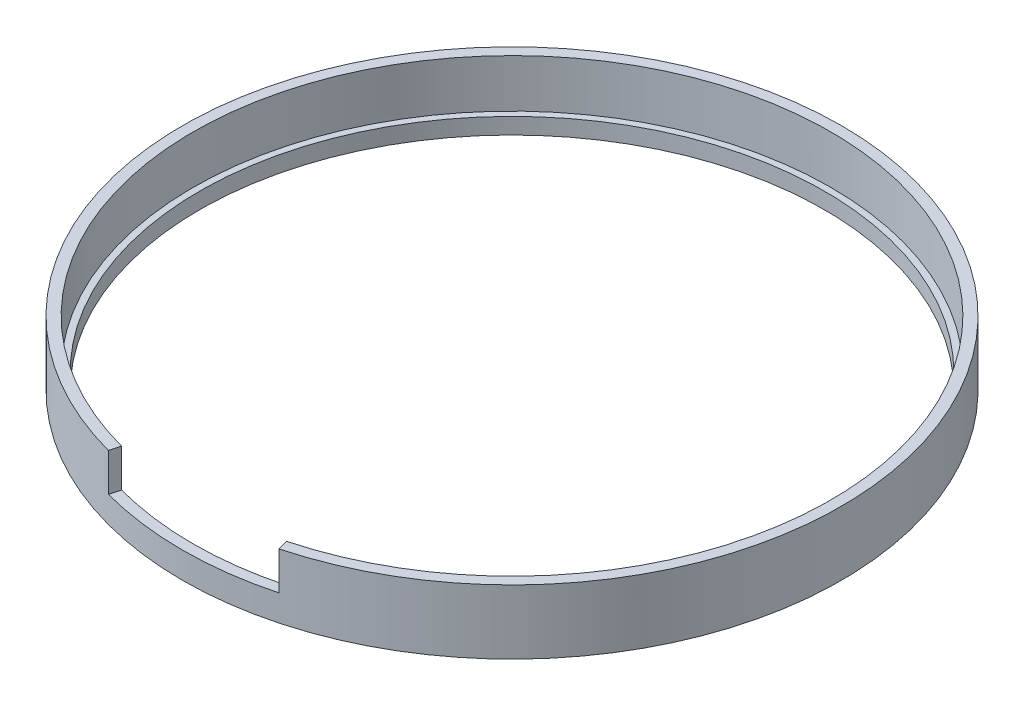
from build123d import *

# Parameters (mm, degrees)
SKETCH_1_R          = 200
SKETCH_1_R_2        = 193.5
EXTRUDE_1_DEPTH     = 39
SKETCH_1_5_R        = 193.5
SKETCH_1_5_R_2      = 189.6
EXTRUDE_2_DEPTH     = 9.8
CUT_EXTRUDE_START   = -23.1
CUT_EXTRUDE_1_DEPTH = 23.1


with BuildPart() as part:
    # 草图1 → 凸台-拉伸1 (new body)
    with BuildSketch(Plane(origin=(0, 0, 0), x_dir=(1, 0, 0), z_dir=(0, 1, 0))):
        with Locations(Location((0, 0, 0), (0, 0, 270))):
            Circle(SKETCH_1_R)
        with Locations(Location((0, 0, 0), (0, 0, 270))):
            Circle(SKETCH_1_R_2, mode=Mode.SUBTRACT)
    extrude(amount=EXTRUDE_1_DEPTH)

    # 草图1<5> → 凸台-拉伸2 (add)
    with BuildSketch(Plane(origin=(0, 0, 0), x_dir=(1, 0, 0), z_dir=(0, 1, 0))):
        with Locations(Location((0, 0, 0), (0, 0, 270))):
            Circle(SKETCH_1_5_R)
        with Locations(Location((0, 0, 0), (0, 0, 270))):
            Circle(SKETCH_1_5_R_2, mode=Mode.SUBTRACT)
    extrude(amount=EXTRUDE_2_DEPTH)

    # 草图4 → 切除-拉伸1 (cut)
    with BuildSketch(Plane(origin=(0, 39, 0), x_dir=(1, 0, 0), z_dir=(0, 1, 0)).offset(CUT_EXTRUDE_START)):
        with BuildLine():
            Line((-50.081485227, -186.906647387), (-51.763809021, -193.185165258))
            ThreePointArc((-51.763809021, -193.185165258), (0, -200), (51.763809021, -193.185165258))
            Line((51.763809021, -193.185165258), (50.081485227, -186.906647387))
            ThreePointArc((50.081485227, -186.906647387), (0, -193.5), (-50.081485227, -186.906647387))
        make_face()
    extrude(amount=CUT_EXTRUDE_1_DEPTH, mode=Mode.SUBTRACT)


solid = part.part
